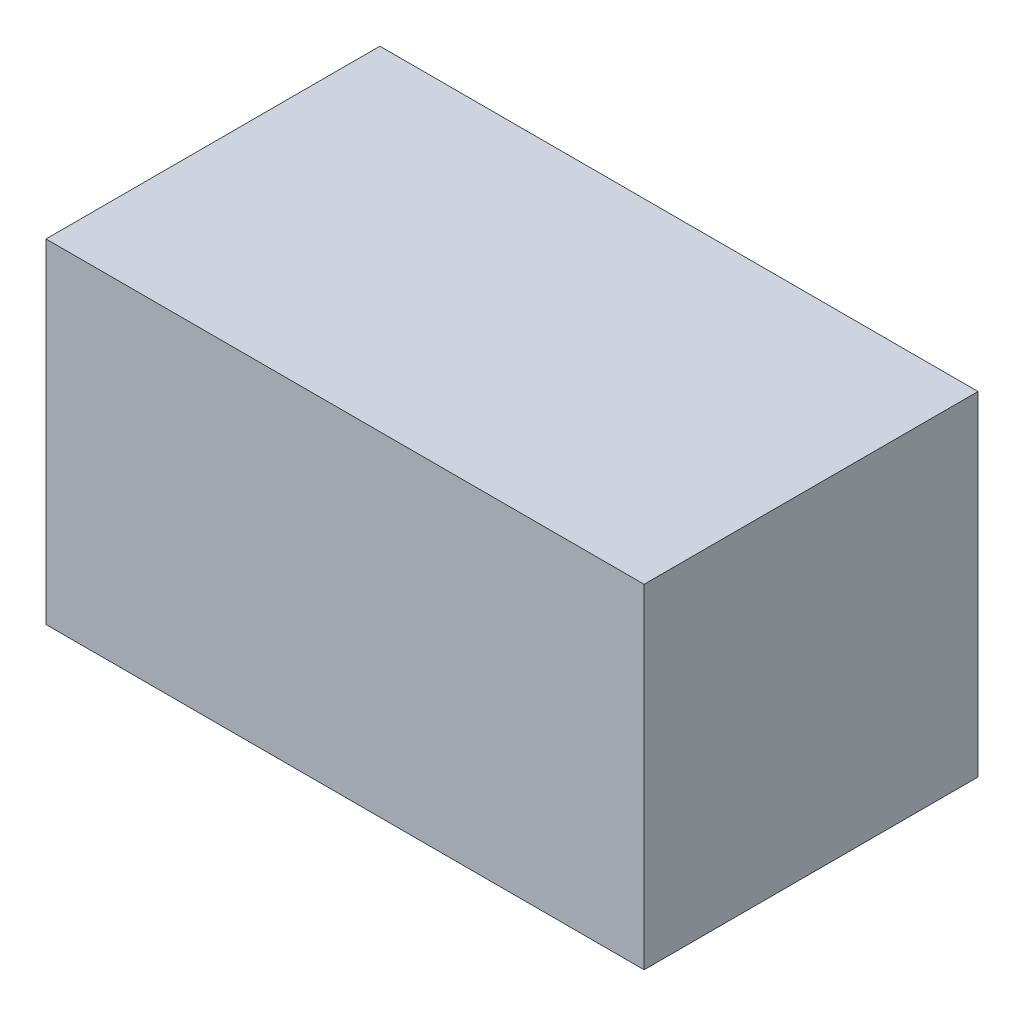
from build123d import *

# Parameters (mm, degrees)
SKETCH_1_W              = 2.5975
SKETCH_1_H              = 1.45
COMPONENT_OUTLINE_DEPTH = 1.45


with BuildPart() as part:
    # 草图1 → Component_Outline (new body)
    with BuildSketch(Plane.XY):
        with Locations((-5e-05, 0)):
            Rectangle(SKETCH_1_W, SKETCH_1_H)
    extrude(amount=COMPONENT_OUTLINE_DEPTH)


solid = part.part
